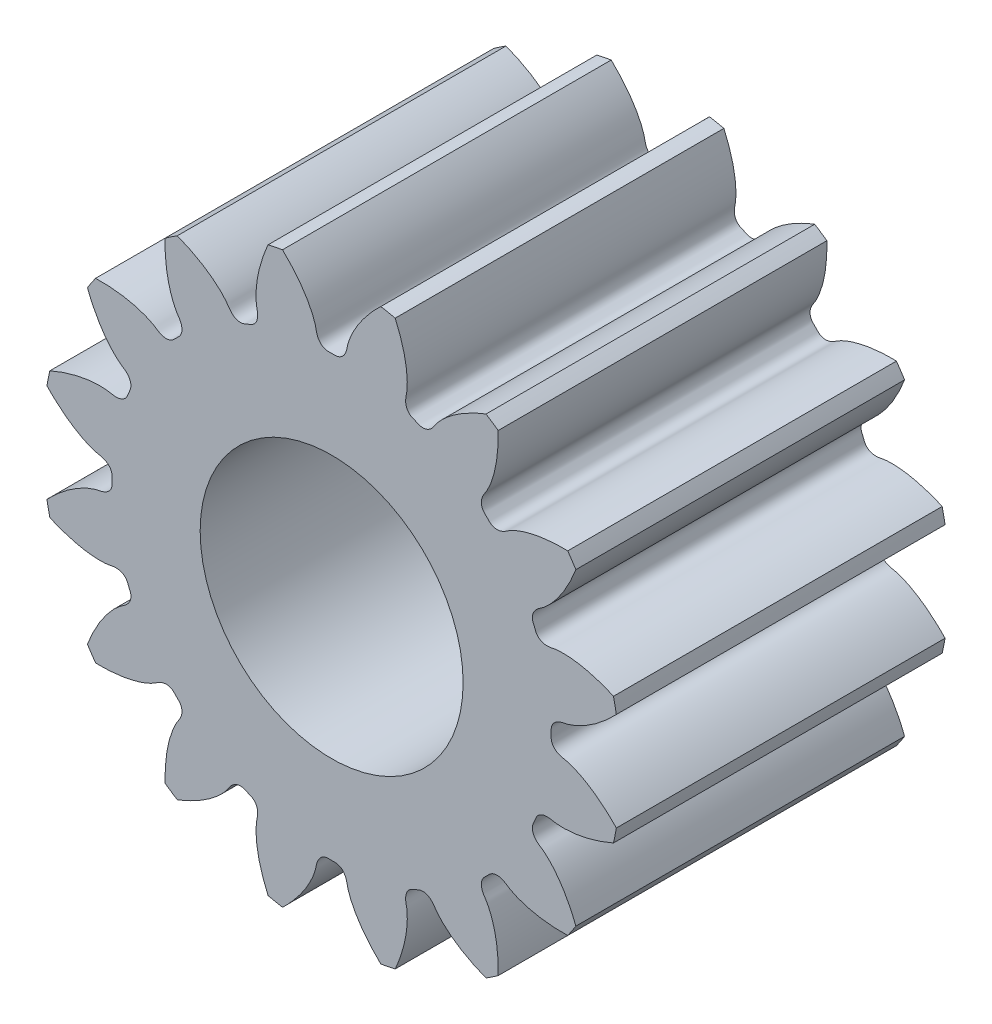
from build123d import *

# Parameters (mm, degrees)
SKETCHREVOLVESPURASSEMBLYNEW1PINION_W       = 10
SKETCHREVOLVESPURASSEMBLYNEW1PINION_H       = 8.7890625
TOOTHEXTRUDECUTSPURASSEMBLYNEW1PINION_START = -8
TOOTHEXTRUDECUTSPURASSEMBLYNEW1PINION_DEPTH = 12
PATTERNSPURASSEMBLYNEW1PINION_COUNT         = 16
SKETCH_1_R                                  = 4
CUT_EXTRUDE_1_DEPTH                         = 16.812131127


with BuildPart() as part:
    # SketchRevolveSpurAssemblyNew1Pinion → SpurAssemblyNew1Pinion (revolve)
    with BuildSketch(Plane(origin=(0, 0, 0), x_dir=(0, 0, -1), z_dir=(1, 0, 0))):
        with Locations((1, 4.39453125)):
            Rectangle(SKETCHREVOLVESPURASSEMBLYNEW1PINION_W, SKETCHREVOLVESPURASSEMBLYNEW1PINION_H)
    revolve(axis=Axis((0, 0, 0), (0, 0, -1)))

    # SketchToothSpurAssemblyNew1Pinion → ToothExtrudeCutSpurAssemblyNew1Pinion (cut)
    with BuildSketch(Plane.XY.offset(TOOTHEXTRUDECUTSPURASSEMBLYNEW1PINION_START)):
        with BuildLine():
            ThreePointArc((8.716029229, 1.554211503), (8.853515625, 0), (8.716029229, -1.554211503))
            add(Edge.make_bspline(
                [(8.716029229, -1.554211503), (8.62862713, -1.459312517), (8.49597106, -1.325274969), (8.314106298, -1.161849014), (8.18489776, -1.054323465), (8.059772215, -0.957996086), (7.9393825, -0.872392365), (7.82435095, -0.797004542), (7.71526784, -0.731293527), (7.612689882, -0.674690752), (7.517138975, -0.626599252), (7.429100479, -0.586397842), (7.349023414, -0.553435542), (7.277314902, -0.527057087), (7.214352885, -0.506532288), (7.160443959, -0.491276196), (7.097952634, -0.475750728), (7.046337113, -0.467920657), (7.004280637, -0.45783036), (6.985712313, -0.452872019), (6.967326671, -0.447394665), (6.949080273, -0.441357303), (6.930926481, -0.434695757), (6.912813897, -0.427331849), (6.894687768, -0.419165828), (6.876491766, -0.410072132), (6.858171606, -0.399892969), (6.839681201, -0.388431378), (6.82099277, -0.375443904), (6.802112664, -0.360634431), (6.783104949, -0.343651932), (6.764124314, -0.32409723), (6.745458017, -0.301546699), (6.727570244, -0.275603076), (6.711137767, -0.245982977), (6.69703376, -0.212637772), (6.686295044, -0.175893357), (6.680036417, -0.13805875), (6.677926166, -0.079083938), (6.68098156, 0), (6.677926166, 0.079083938), (6.680036417, 0.13805875), (6.686295044, 0.175893357), (6.69703376, 0.212637772), (6.711137767, 0.245982977), (6.727570244, 0.275603076), (6.745458017, 0.301546699), (6.764124314, 0.32409723), (6.783104949, 0.343651932), (6.802112664, 0.360634431), (6.82099277, 0.375443904), (6.839681201, 0.388431378), (6.858171606, 0.399892969), (6.876491766, 0.410072132), (6.894687768, 0.419165828), (6.912813897, 0.427331849), (6.930926481, 0.434695757), (6.949080273, 0.441357303), (6.967326671, 0.447394665), (6.985712313, 0.452872019), (7.004280637, 0.45783036), (7.046337113, 0.467920657), (7.097952634, 0.475750728), (7.160443959, 0.491276196), (7.214352885, 0.506532288), (7.277314902, 0.527057087), (7.349023414, 0.553435542), (7.429100479, 0.586397842), (7.517138975, 0.626599252), (7.612689882, 0.674690752), (7.71526784, 0.731293527), (7.82435095, 0.797004542), (7.9393825, 0.872392365), (8.059772215, 0.957996086), (8.18489776, 1.054323465), (8.314106298, 1.161849014), (8.49597106, 1.325274969), (8.62862713, 1.459312517), (8.716029229, 1.554211503)],
                knots=[0, 0, 0, 0, 0.071940146, 0.105070476, 0.136307645, 0.165651652, 0.193102497, 0.218660181, 0.242324703, 0.264096063, 0.283974262, 0.301959299, 0.318051175, 0.332249889, 0.344555442, 0.354967833, 0.363487062, 0.380444448, 0.384031118, 0.387599323, 0.39116026, 0.394726966, 0.398314667, 0.401941182, 0.405627388, 0.409397748, 0.413280862, 0.417309997, 0.421523496, 0.425964841, 0.430682071, 0.43572602, 0.44114668, 0.446986911, 0.453273001, 0.460002642, 0.467132884, 0.474573007, 0.481318675, 0.5, 0.518681325, 0.525426993, 0.532867116, 0.539997358, 0.546726999, 0.553013089, 0.55885332, 0.56427398, 0.569317929, 0.574035159, 0.578476504, 0.582690003, 0.586719138, 0.590602252, 0.594372612, 0.598058818, 0.601685333, 0.605273034, 0.60883974, 0.612400677, 0.615968882, 0.619555552, 0.636512938, 0.645032167, 0.655444558, 0.667750111, 0.681948825, 0.698040701, 0.716025738, 0.735903937, 0.757675297, 0.781339819, 0.806897503, 0.834348348, 0.863692355, 0.894929524, 0.928059854, 1, 1, 1, 1], degree=3))
        make_face()
    toothextrudecutspurassemblynew1pinion = extrude(amount=TOOTHEXTRUDECUTSPURASSEMBLYNEW1PINION_DEPTH, mode=Mode.SUBTRACT)

    # PatternSpurAssemblyNew1Pinion: ToothExtrudeCutSpurAssemblyNew1Pinion ×16 about axis
    patternspurassemblynew1pinion_axis = Axis((0, 0, 50), (0, 0, -1))
    for i in range(1, PATTERNSPURASSEMBLYNEW1PINION_COUNT):
        add(toothextrudecutspurassemblynew1pinion.rotate(patternspurassemblynew1pinion_axis, i * 360 / PATTERNSPURASSEMBLYNEW1PINION_COUNT), mode=Mode.SUBTRACT)

    # Эскиз1 → Вырез-Вытянуть1 (cut, through all)
    with BuildSketch(Plane.XY.offset(4)):
        Circle(SKETCH_1_R)
    extrude(amount=-CUT_EXTRUDE_1_DEPTH, mode=Mode.SUBTRACT)


solid = part.part
